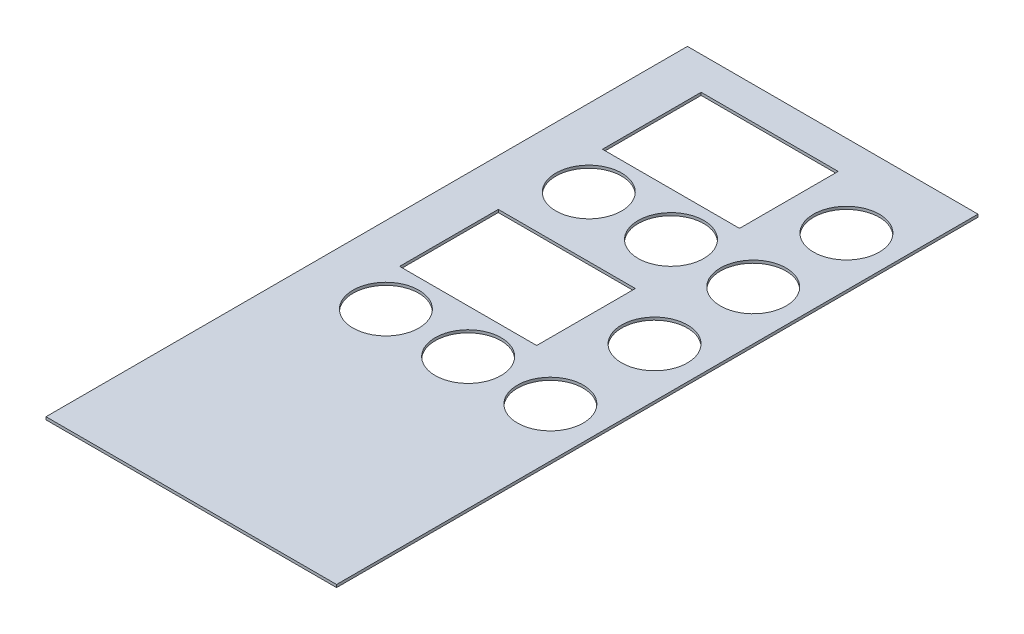
from build123d import *

# Parameters (mm, degrees)
SKETCH_1_W          = 53
SKETCH_1_H          = 117
EXTRUDE_1_DEPTH     = 0.5
SKETCH_2_W          = 25
SKETCH_2_H          = 18
CUT_EXTRUDE_1_DEPTH = 65.224216616
SKETCH_4_R          = 6
CUT_EXTRUDE_2_DEPTH = 65.224216616


with BuildPart() as part:
    # Эскиз1 → Бобышка-Вытянуть1 (new body)
    with BuildSketch(Plane(origin=(0, 0, 0), x_dir=(1, 0, 0), z_dir=(0, 1, 0))):
        Rectangle(SKETCH_1_W, SKETCH_1_H)
    extrude(amount=EXTRUDE_1_DEPTH)

    # Эскиз2 → Вырез-Вытянуть1 (cut, through all)
    with BuildSketch(Plane(origin=(0, 0.5, 0), x_dir=(1, 0, 0), z_dir=(0, 1, 0))):
        with Locations((-5.5, 43.5)):
            Rectangle(SKETCH_2_W, SKETCH_2_H)
        with Locations((-5.5, 6.5)):
            Rectangle(SKETCH_2_W, SKETCH_2_H)
    extrude(amount=-CUT_EXTRUDE_1_DEPTH, mode=Mode.SUBTRACT)

    # Эскиз4 → Вырез-Вытянуть2 (cut, through all)
    with BuildSketch(Plane(origin=(0, 0.5, 0), x_dir=(1, 0, 0), z_dir=(0, 1, 0))):
        with Locations(Location((17.5, 43.5, 0), (0, 0, 270))):
            Circle(SKETCH_4_R)
        with Locations(Location((17.5, 26.5, 0), (0, 0, 270))):
            Circle(SKETCH_4_R)
        with Locations(Location((17.5, 8.5, 0), (0, 0, 270))):
            Circle(SKETCH_4_R)
        with Locations(Location((17.5, -10.5, 0), (0, 0, 270))):
            Circle(SKETCH_4_R)
        with Locations(Location((2.5, 26.5, 0), (0, 0, 270))):
            Circle(SKETCH_4_R)
        with Locations(Location((-12.5, 26.5, 0), (0, 0, 270))):
            Circle(SKETCH_4_R)
        with Locations(Location((2.5, -10.5, 0), (0, 0, 270))):
            Circle(SKETCH_4_R)
        with Locations(Location((-12.5, -10.5, 0), (0, 0, 270))):
            Circle(SKETCH_4_R)
    extrude(amount=-CUT_EXTRUDE_2_DEPTH, mode=Mode.SUBTRACT)


solid = part.part
